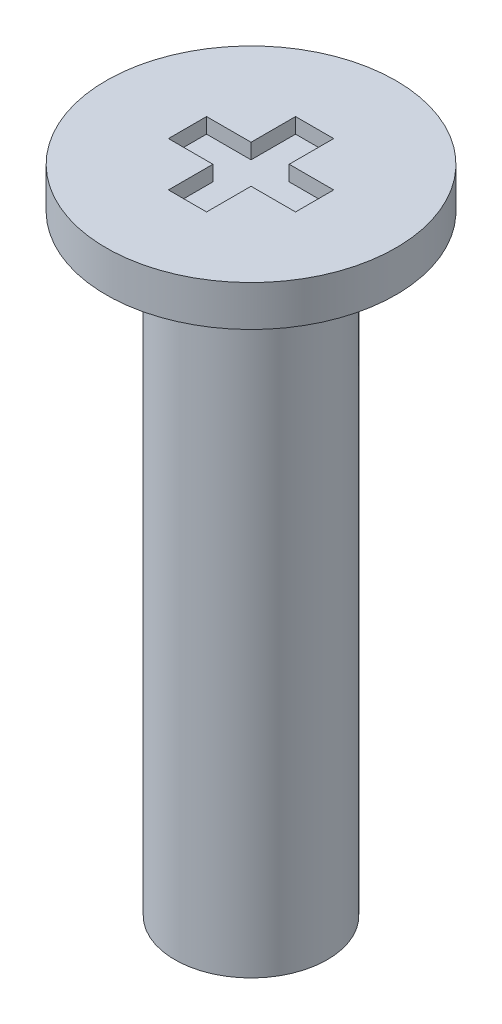
from build123d import *

# Parameters (mm, degrees)
SKETCH_2_W               = 0.75
SKETCH_2_H               = 1.25
CUT_EXTRUDE_1_DEPTH      = 0.3
PATTERN_CIRCULAR_1_COUNT = 4


with BuildPart() as part:
    # ｽｹｯﾁ1 → 回転1 (revolve)
    with BuildSketch(Plane.XY, mode=Mode.PRIVATE) as revolve_1_sk:
        Polygon((0, 0), (2.85, 0), (2.85, -0.8), (1.5, -0.8), (1.5, -12.8), (0, -12.8), align=None)
    revolve(revolve_1_sk.sketch.rotate(Axis((0, -12.8, 0), (0, 1, 0)), 90), axis=Axis((0, -12.8, 0), (0, 1, 0)))

    # ｽｹｯﾁ2 → ｶｯﾄ - 押し出し1 (cut)
    with BuildSketch(Plane(origin=(0, 0, 0), x_dir=(1, 0, 0), z_dir=(0, 1, 0))):
        with Locations((0, 0.625)):
            Rectangle(SKETCH_2_W, SKETCH_2_H)
    cut_extrude_1 = extrude(amount=-CUT_EXTRUDE_1_DEPTH, mode=Mode.SUBTRACT)

    # 円形ﾊﾟﾀｰﾝ1: ｶｯﾄ - 押し出し1 ×4 about axis
    pattern_circular_1_axis = Axis((0, 0, 0), (0, 1, 0))
    for i in range(1, PATTERN_CIRCULAR_1_COUNT):
        add(cut_extrude_1.rotate(pattern_circular_1_axis, i * 360 / PATTERN_CIRCULAR_1_COUNT), mode=Mode.SUBTRACT)


solid = part.part
